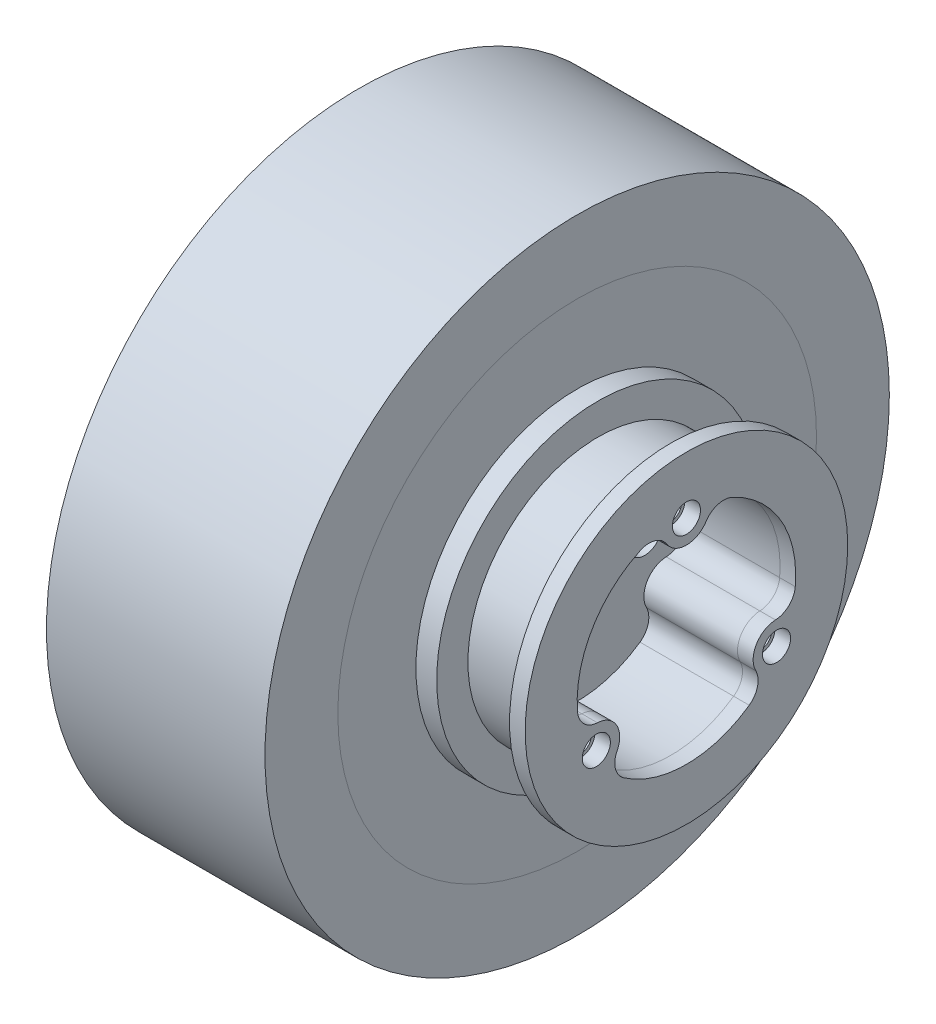
from build123d import *

# Parameters (mm, degrees)
SKETCH_1_R          = 23
SKETCH_1_R_2        = 21
EXTRUDE_1_DEPTH     = 17
SKETCH_2_R          = 23
EXTRUDE_2_DEPTH     = 4
SKETCH_3_R          = 1.6
CUT_EXTRUDE_1_DEPTH = 4
SKETCH_5_R          = 30
SKETCH_5_R_2        = 23
EXTRUDE_4_DEPTH     = 21
SKETCH_6_R          = 3.4925
CUT_EXTRUDE_2_DEPTH = 10
SKETCH_12_R         = 12.5
SKETCH_12_R_2       = 10.5
EXTRUDE_5_DEPTH     = 9
SKETCH_13_R         = 15.5
SKETCH_13_R_2       = 12.5
EXTRUDE_6_DEPTH     = 2
SKETCH_14_R         = 2.25
EXTRUDE_7_DEPTH     = 10
FILLET_2_R          = 2
SKETCH_15_R         = 1.025
CUT_EXTRUDE_3_DEPTH = 33
MOVE_FACE_1_BY      = 0.3
SKETCH_16_R         = 15.5
SKETCH_16_R_2       = 1.35
EXTRUDE_8_DEPTH     = 1.5
FILLET_3_R          = 2


with BuildPart() as part:
    # 草图1 → 凸台-拉伸1 (new body)
    with BuildSketch(Plane(origin=(0, 0, 0), x_dir=(0, 0, -1), z_dir=(1, 0, 0))):
        Circle(SKETCH_1_R)
        Circle(SKETCH_1_R_2, mode=Mode.SUBTRACT)
    extrude(amount=EXTRUDE_1_DEPTH)

    # 草图2 → 凸台-拉伸2 (add)
    with BuildSketch(Plane(origin=(17, 0, 0), x_dir=(0, 0, -1), z_dir=(1, 0, 0))):
        Circle(SKETCH_2_R)
    extrude(amount=EXTRUDE_2_DEPTH)

    # 草图3 → 切除-拉伸1 (cut)
    with BuildSketch(Plane(origin=(21, 0, 0), x_dir=(0, 0, -1), z_dir=(1, 0, 0))):
        with Locations((6.5, 0)):
            Circle(SKETCH_3_R)
        with Locations(Location((-6.5, 0, 0), (0, 0, 180))):
            Circle(SKETCH_3_R)
    extrude(amount=-CUT_EXTRUDE_1_DEPTH, mode=Mode.SUBTRACT)

    # 草图6 → 切除-拉伸2 (cut)
    with BuildSketch(Plane(origin=(21, 0, 0), x_dir=(0, 0, -1), z_dir=(1, 0, 0))):
        Circle(SKETCH_6_R)
    extrude(amount=-CUT_EXTRUDE_2_DEPTH, mode=Mode.SUBTRACT)

    # 草图12 → 凸台-拉伸5 (add)
    with BuildSketch(Plane(origin=(21, 0, 0), x_dir=(0, 0, -1), z_dir=(1, 0, 0))):
        Circle(SKETCH_12_R)
        Circle(SKETCH_12_R_2, mode=Mode.SUBTRACT)
    extrude(amount=EXTRUDE_5_DEPTH)

    # 草图13 → 凸台-拉伸6 (add)
    with BuildSketch(Plane(origin=(21, 0, 0), x_dir=(0, 0, -1), z_dir=(1, 0, 0))):
        Circle(SKETCH_13_R)
        Circle(SKETCH_13_R_2, mode=Mode.SUBTRACT)
    extrude(amount=EXTRUDE_6_DEPTH)

    # 草图14 → 凸台-拉伸7 (add)
    with BuildSketch(Plane(origin=(30, 0, 0), x_dir=(0, 0, -1), z_dir=(1, 0, 0))):
        with Locations((0, 10)):
            Circle(SKETCH_14_R)
        with Locations((8.660254038, -5)):
            Circle(SKETCH_14_R)
        with Locations((-8.660254038, -5)):
            Circle(SKETCH_14_R)
    extrude(amount=-EXTRUDE_7_DEPTH)

    # 圆角2
    fillet_2_edges = [part.edges().sort_by_distance(p)[0] for p in [
        (25.5, 10.259375, 2.234999913),
        (25.5, 10.259375, -2.234999913),
        (25.5, -7.065254202, 7.767379421),
        (25.5, -3.194120798, 10.002379333),
        (25.5, -3.194120798, -10.002379333),
        (25.5, -7.065254202, -7.767379421),
    ]]
    fillet(fillet_2_edges, radius=FILLET_2_R)

    # 草图15 → 切除-拉伸3 (cut)
    with BuildSketch(Plane(origin=(30, 0, 0), x_dir=(0, 0, -1), z_dir=(1, 0, 0))):
        with Locations((0, 10)):
            Circle(SKETCH_15_R)
        with Locations((8.660254038, -5)):
            Circle(SKETCH_15_R)
        with Locations((-8.660254038, -5)):
            Circle(SKETCH_15_R)
    extrude(amount=-CUT_EXTRUDE_3_DEPTH, mode=Mode.SUBTRACT)

    # Move Face 1: a curved face moved inward by 0.3
    add(Solid.thicken(part.faces().sort_by_distance((8.5, 0, 21))[0], -MOVE_FACE_1_BY), mode=Mode.SUBTRACT)


with BuildPart() as body_2:
    # 草图5 → 凸台-拉伸4 (new body)
    with BuildSketch(Plane(origin=(21, 0, 0), x_dir=(0, 0, -1), z_dir=(1, 0, 0))):
        Circle(SKETCH_5_R)
        Circle(SKETCH_5_R_2, mode=Mode.SUBTRACT)
    extrude(amount=-EXTRUDE_4_DEPTH)


with BuildPart() as body_3:
    # 草图16 → 凸台-拉伸8 (new body)
    with BuildSketch(Plane(origin=(30, 0, 0), x_dir=(0, 0, -1), z_dir=(1, 0, 0))):
        Circle(SKETCH_16_R)
        with Locations((0, 10)):
            Circle(SKETCH_16_R_2, mode=Mode.SUBTRACT)
        with Locations((8.660254038, -5)):
            Circle(SKETCH_16_R_2, mode=Mode.SUBTRACT)
        with Locations((-8.660254038, -5)):
            Circle(SKETCH_16_R_2, mode=Mode.SUBTRACT)
        with BuildLine():
            ThreePointArc((-2.234999913, 10.259375), (0, 7.75), (2.234999913, 10.259375))
            ThreePointArc((2.234999913, 10.259375), (9.09326674, 5.25), (10.002379333, -3.194120798))
            ThreePointArc((10.002379333, -3.194120798), (6.711696879, -3.875), (7.767379421, -7.065254202))
            ThreePointArc((7.767379421, -7.065254202), (0, -10.5), (-7.767379421, -7.065254202))
            ThreePointArc((-7.767379421, -7.065254202), (-6.711696879, -3.875), (-10.002379333, -3.194120798))
            ThreePointArc((-10.002379333, -3.194120798), (-9.09326674, 5.25), (-2.234999913, 10.259375))
        make_face(mode=Mode.SUBTRACT)
    extrude(amount=EXTRUDE_8_DEPTH)

    # 圆角3
    fillet_3_edges = [body_3.edges().sort_by_distance(p)[0] for p in [
        (30.75, -3.194120798, -10.002379333),
        (30.75, 10.259375, -2.234999913),
        (30.75, 10.259375, 2.234999913),
        (30.75, -3.194120798, 10.002379333),
        (30.75, -7.065254202, 7.767379421),
        (30.75, -7.065254202, -7.767379421),
    ]]
    fillet(fillet_3_edges, radius=FILLET_3_R)


solid = Compound([part.part, body_2.part, body_3.part])
